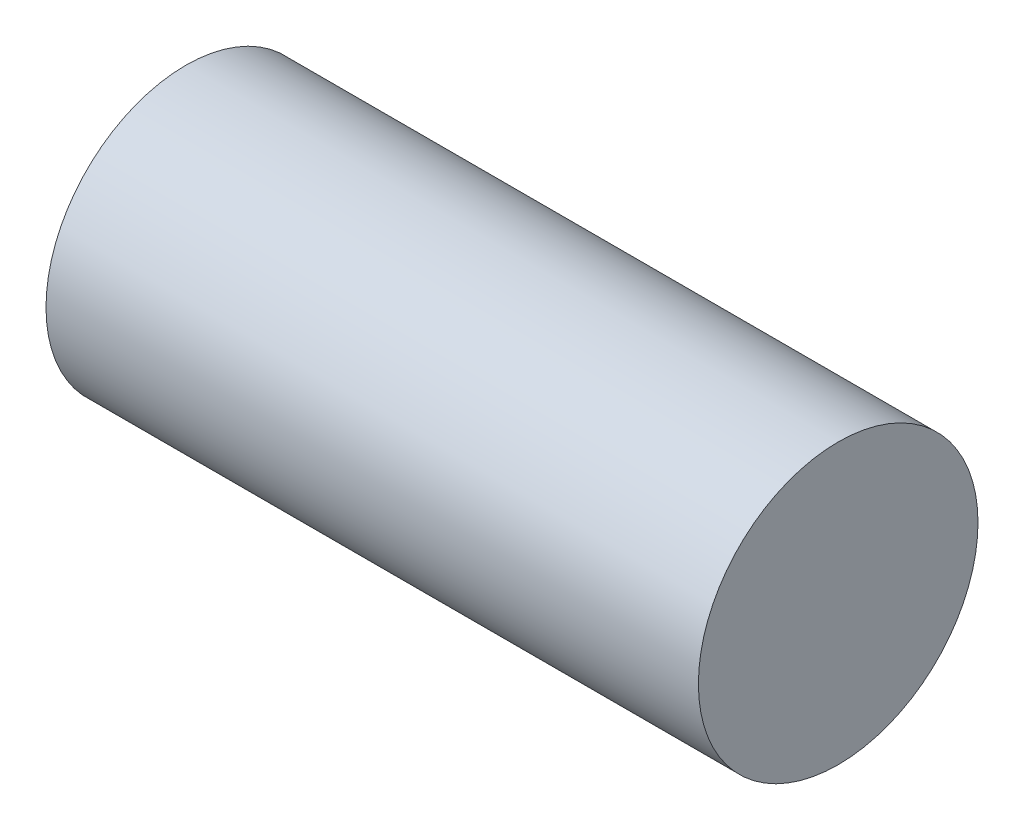
from build123d import *

# Parameters (mm, degrees)
SKETCH1_R           = 15
BOSS_EXTRUDE1_DEPTH = 70


with BuildPart() as part:
    # Sketch1 → Boss-Extrude1 (new body)
    with BuildSketch(Plane(origin=(0, 0, 0), x_dir=(0, 0, -1), z_dir=(1, 0, 0))):
        Circle(SKETCH1_R)
    extrude(amount=BOSS_EXTRUDE1_DEPTH)


solid = part.part
